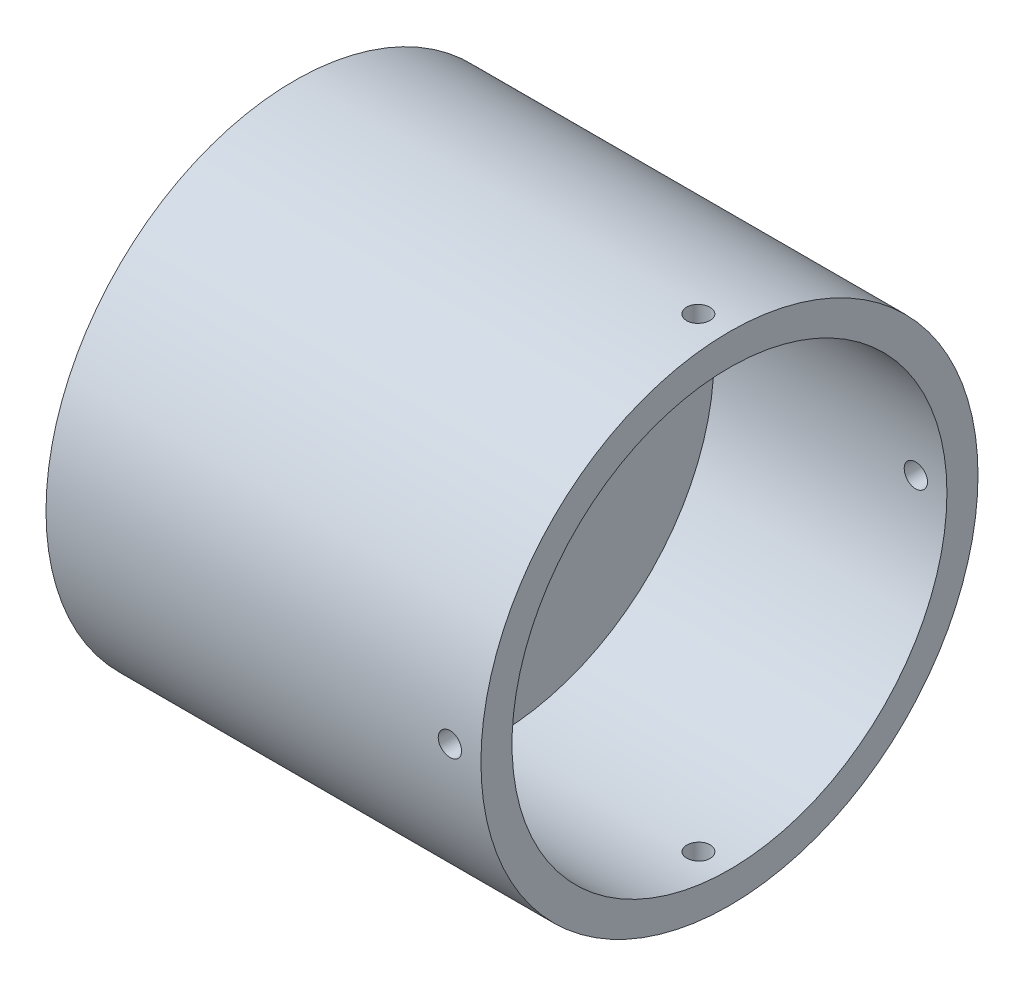
from build123d import *

# Parameters (mm, degrees)
BASPROSKE_W              = 9
BASPROSKE_H              = 2.8
TOOTHCUT_DEPTH           = 25.351591324
TEETHCUTS_COUNT          = 46
EXTRUDE_START            = 4
SKETCH_1_R               = 16
SKETCH_1_R_2             = 6
EXTRUDE_1_DEPTH          = 4
EXTRUDE_START_2          = 19
SKETCH_1_3_R             = 16
SKETCH_1_3_R_2           = 14
EXTRUDE_2_DEPTH          = 15
CUT_EXTRUDE_1_DEPTH      = 30.546573405
CUT_EXTRUDE_1_DEPTH_BACK = 30.546573405
SKETCH_3_R               = 1
SKETCH_3_3_R             = 2.25
SKETCH_3_3_R_2           = 1
CUT_EXTRUDE_2_DEPTH      = 3
CUT_EXTRUDE_3_DEPTH      = 37
CUT_EXTRUDE_3_DEPTH_BACK = 37
SKETCH_4_R               = 0.75
CUT_EXTRUDE_4_DEPTH      = 37.000000167
CUT_EXTRUDE_4_DEPTH_BACK = 37.000000167
SKETCH_5_R               = 0.75


with BuildPart() as part:
    # BasProSke → Base-Revolve (revolve)
    with BuildSketch(Plane(origin=(0, 0, 0), x_dir=(1, 0, 0), z_dir=(0, 1, 0)), mode=Mode.PRIVATE) as base_revolve_sk:
        with Locations((4.5, 14.6)):
            Rectangle(BASPROSKE_W, BASPROSKE_H)
    revolve(base_revolve_sk.sketch.rotate(Axis((-10, 0, 0), (1, 0, 0)), 180), axis=Axis((-10, 0, 0), (1, 0, 0)))

    # TooCutSke → ToothCut (cut, through all)
    with BuildSketch(Plane(origin=(0, 0, 0), x_dir=(0, 0, -1), z_dir=(1, 0, 0))):
        with BuildLine():
            ThreePointArc((0.740467172, 13.153774877), (0.498123412, 13.867172171), (0.17944214, 14.549893523))
            ThreePointArc((0.17944214, 14.549893523), (0, 14.551), (-0.17944214, 14.549893523))
            ThreePointArc((-0.17944214, 14.549893523), (-0.498123412, 13.867172171), (-0.740467172, 13.153774877))
            ThreePointArc((-0.740467172, 13.153774877), (0, 13.1746), (0.740467172, 13.153774877))
        make_face()
    toothcut = extrude(amount=TOOTHCUT_DEPTH, mode=Mode.SUBTRACT)

    # TeethCuts: ToothCut ×46 about axis
    teethcuts_axis = Axis((0, 0, 0), (1, 0, 0))
    for i in range(1, TEETHCUTS_COUNT):
        add(toothcut.rotate(teethcuts_axis, i * 360 / TEETHCUTS_COUNT), mode=Mode.SUBTRACT)

    # 草图1 → 凸台-拉伸1 (add)
    with BuildSketch(Plane(origin=(9, 0, 0), x_dir=(0, 0, -1), z_dir=(1, 0, 0)).offset(EXTRUDE_START)):
        with Locations(Location((0, 0, 0), (0, 0, 180))):
            Circle(SKETCH_1_R)
        Circle(SKETCH_1_R_2, mode=Mode.SUBTRACT)
    extrude(amount=-EXTRUDE_1_DEPTH)

    # 草图1<3> → 凸台-拉伸2 (add)
    with BuildSketch(Plane(origin=(9, 0, 0), x_dir=(0, 0, -1), z_dir=(1, 0, 0)).offset(EXTRUDE_START_2)):
        with Locations(Location((0, 0, 0), (0, 0, 180))):
            Circle(SKETCH_1_3_R)
        Circle(SKETCH_1_3_R_2, mode=Mode.SUBTRACT)
    extrude(amount=-EXTRUDE_2_DEPTH)

    # 草图3 → 切除-拉伸1 (cut, two sides: drawn at the far end of the back side and taken through both)
    with BuildSketch(Plane.ZY.offset(-9).offset(-CUT_EXTRUDE_1_DEPTH_BACK)):
        with Locations(Location((0, 8.375, 0), (0, 0, 180))):
            Circle(SKETCH_3_R)
        with Locations(Location((0, -8.375, 0), (0, 0, 180))):
            Circle(SKETCH_3_R)
    extrude(amount=CUT_EXTRUDE_1_DEPTH + CUT_EXTRUDE_1_DEPTH_BACK, mode=Mode.SUBTRACT)

    # 草图3<3> → 切除-拉伸2 (cut)
    # profile 1 of 2: a face of its own
    with BuildSketch(Plane.ZY.offset(-9)):
        with Locations((0, -8.375)):
            Circle(SKETCH_3_3_R)
        with Locations((0, -8.375)):
            Circle(SKETCH_3_3_R_2, mode=Mode.SUBTRACT)
    # profile 2 of 2: a face of its own
    with BuildSketch(Plane.ZY.offset(-9)):
        with Locations((0, 8.375)):
            Circle(SKETCH_3_3_R)
        with Locations((0, 8.375)):
            Circle(SKETCH_3_3_R_2, mode=Mode.SUBTRACT)
    extrude(amount=-CUT_EXTRUDE_2_DEPTH, mode=Mode.SUBTRACT)

    # 草图4 → 切除-拉伸3 (cut, two sides: drawn at the far end of the back side and taken through both)
    with BuildSketch(Plane(origin=(0, 0, 0), x_dir=(1, 0, 0), z_dir=(0, 1, 0)).offset(-CUT_EXTRUDE_3_DEPTH_BACK)):
        with Locations(Location((26, 0, 0), (0, 0, 270))):
            Circle(SKETCH_4_R)
    extrude(amount=CUT_EXTRUDE_3_DEPTH + CUT_EXTRUDE_3_DEPTH_BACK, mode=Mode.SUBTRACT)

    # 草图5 → 切除-拉伸4 (cut, two sides: drawn at the far end of the back side and taken through both)
    with BuildSketch(Plane.XY.offset(-CUT_EXTRUDE_4_DEPTH_BACK)):
        with Locations((26, 0)):
            Circle(SKETCH_5_R)
    extrude(amount=CUT_EXTRUDE_4_DEPTH + CUT_EXTRUDE_4_DEPTH_BACK, mode=Mode.SUBTRACT)


solid = part.part
